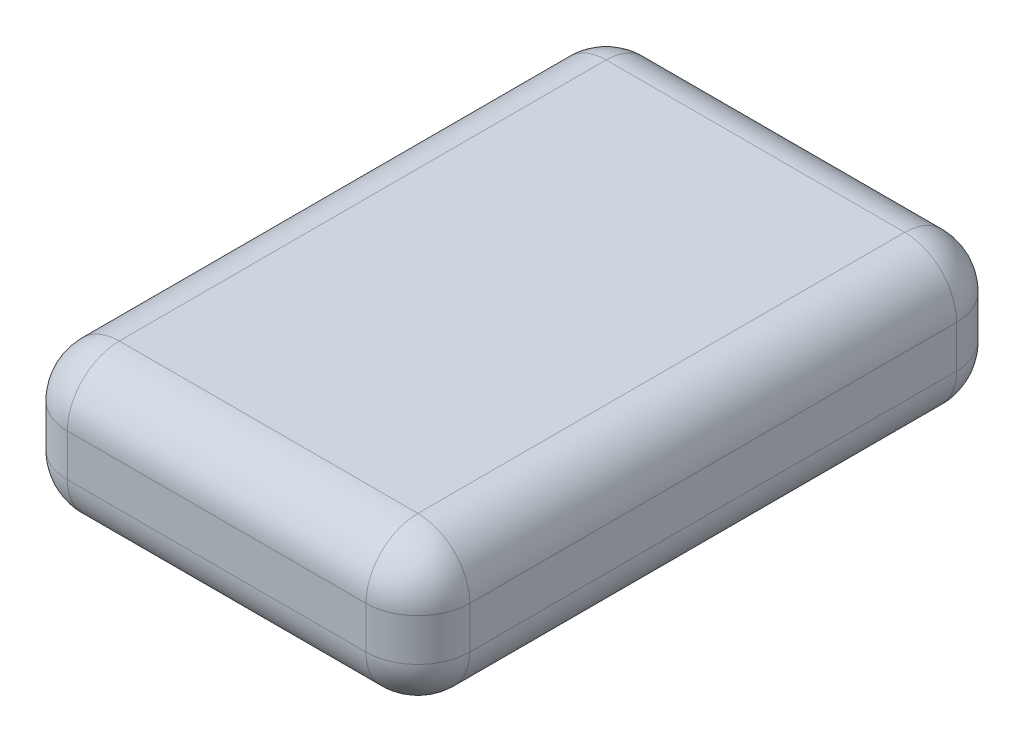
from build123d import *

# Parameters (mm, degrees)
SKETCH1_W           = 62
SKETCH1_H           = 91
BOSS_EXTRUDE1_DEPTH = 22.5
FILLET1_R           = 8


with BuildPart() as part:
    # Sketch1 → Boss-Extrude1 (new body)
    with BuildSketch(Plane(origin=(0, 0, 0), x_dir=(1, 0, 0), z_dir=(0, 1, 0))):
        Rectangle(SKETCH1_W, SKETCH1_H)
    extrude(amount=BOSS_EXTRUDE1_DEPTH)

    # Fillet1
    fillet1_edges = [part.edges().sort_by_distance(p)[0] for p in [
        (-31, 22.5, 0),
        (0, 22.5, 45.5),
        (31, 22.5, 0),
        (0, 0, 45.5),
        (-31, 0, 0),
        (0, 0, -45.5),
        (31, 0, 0),
        (31, 11.25, 45.5),
        (-31, 11.25, 45.5),
        (-31, 11.25, -45.5),
        (31, 11.25, -45.5),
        (0, 22.5, -45.5),
    ]]
    fillet(fillet1_edges, radius=FILLET1_R)


solid = part.part
